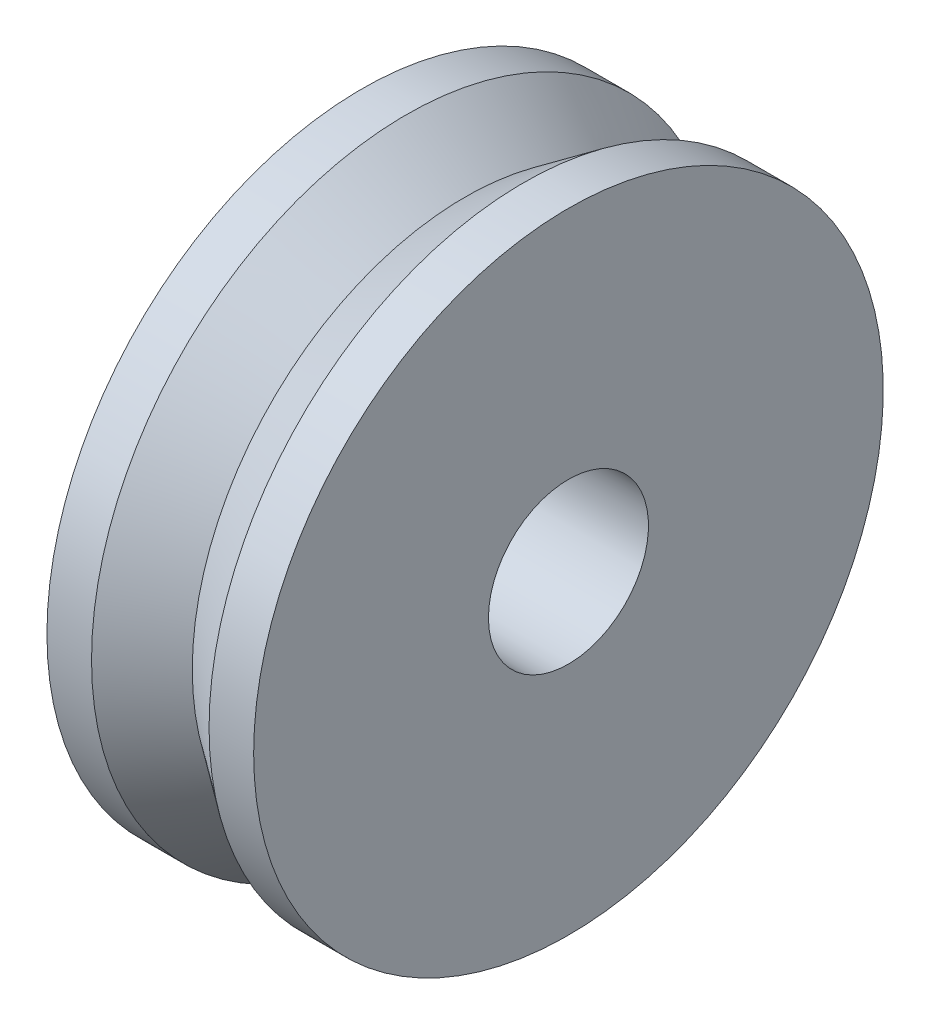
from build123d import *

# Parameters (mm, degrees)
SKETCH2_R          = 1.525
CUT_EXTRUDE1_DEPTH = 12.61787595


with BuildPart() as part:
    # Sketch1 → Revolve1 (revolve)
    with BuildSketch(Plane.XY, mode=Mode.PRIVATE) as revolve1_sk:
        Polygon((-1.68761801, 2.864823944), (-0.83761801, 2.864823944), (0.28238199, 2.064823944), (1.40238199, 2.864823944), (2.25238199, 2.864823944), (2.25238199, -3.135176056), (-1.68761801, -3.135176056), align=None)
    revolve(revolve1_sk.sketch.rotate(Axis((-1.68761801, -3.135176056, 0), (1, 0, 0)), 90), axis=Axis((-1.68761801, -3.135176056, 0), (1, 0, 0)))

    # Sketch2 → Cut-Extrude1 (cut, through all)
    with BuildSketch(Plane.ZY.offset(1.68761801)):
        with Locations((0, -3.135176056)):
            Circle(SKETCH2_R)
    extrude(amount=-CUT_EXTRUDE1_DEPTH, mode=Mode.SUBTRACT)


solid = part.part
